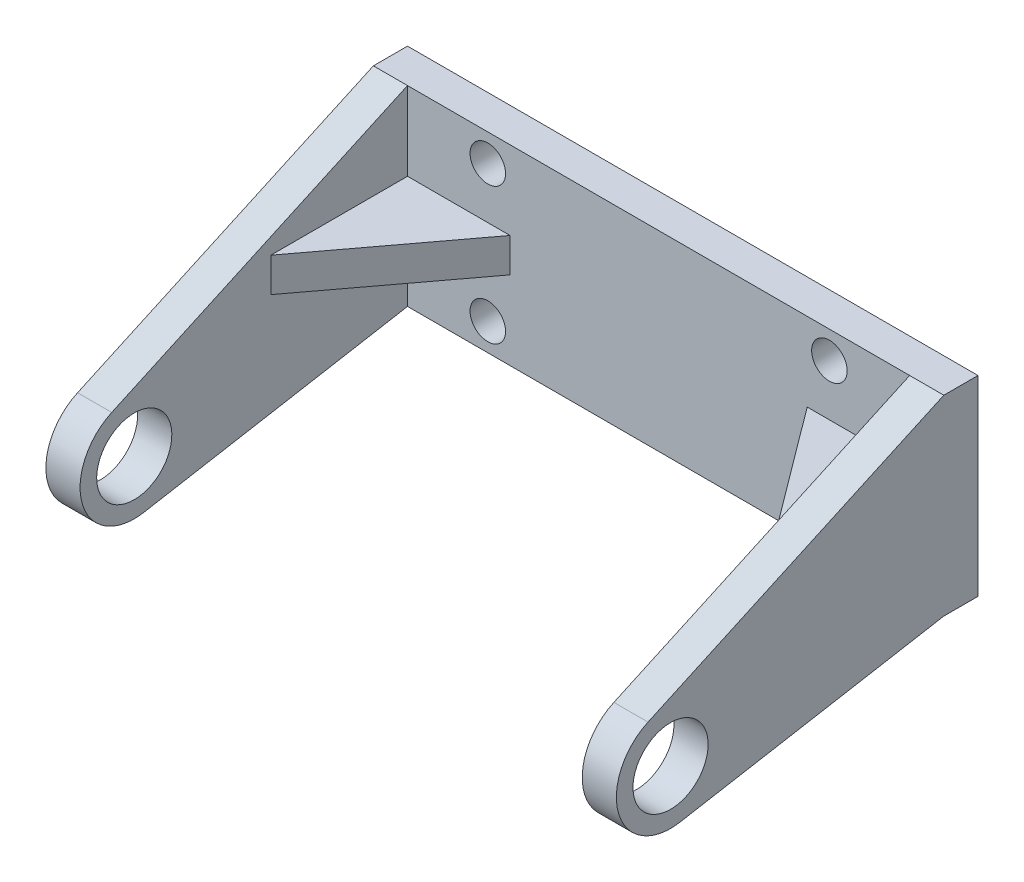
from build123d import *

# Parameters (mm, degrees)
SKETCH_1_W          = 83.5
SKETCH_1_H          = 28
EXTRUDE_1_DEPTH     = 5
SKETCH_2_R          = 5.5
EXTRUDE_2_DEPTH     = 5
EXTRUDE_START       = -5
SKETCH_3_R          = 5.5
EXTRUDE_3_DEPTH     = 5
SKETCH_4_R          = 2.6
CUT_EXTRUDE_2_DEPTH = 5
EXTRUDE_4_DEPTH     = 2.5


with BuildPart() as part:
    # 草图1 → 凸台-拉伸1 (new body)
    with BuildSketch(Plane.XY):
        Rectangle(SKETCH_1_W, SKETCH_1_H)
    extrude(amount=EXTRUDE_1_DEPTH)

    # 草图2 → 凸台-拉伸2 (add)
    with BuildSketch(Plane.ZY.offset(41.75)):
        with BuildLine():
            Line((5, 14), (5, -14))
            Line((5, -14), (43.622842344, -20.810249177))
            ThreePointArc((43.622842344, -20.810249177), (52.5727616, -15.355809237), (48.296475179, -5.786831015))
            Line((48.296475179, -5.786831015), (5, 14))
        make_face()
        with Locations(Location((45, -13, 0), (0, 0, 270))):
            Circle(SKETCH_2_R, mode=Mode.SUBTRACT)
    extrude(amount=-EXTRUDE_2_DEPTH)

    # 草图3 → 凸台-拉伸3 (add)
    with BuildSketch(Plane(origin=(41.75, 0, 0), x_dir=(0, 0, -1), z_dir=(1, 0, 0)).offset(EXTRUDE_START)):
        with BuildLine():
            Line((-5, 14), (-48.296475179, -5.786831015))
            ThreePointArc((-48.296475179, -5.786831015), (-52.5727616, -15.355809237), (-43.622842344, -20.810249177))
            Line((-43.622842344, -20.810249177), (-5, -14))
            Line((-5, -14), (-5, 14))
        make_face()
        with Locations(Location((-45, -13, 0), (0, 0, 270))):
            Circle(SKETCH_3_R, mode=Mode.SUBTRACT)
    extrude(amount=EXTRUDE_3_DEPTH)

    # 草图4 → 切除-拉伸2 (cut)
    with BuildSketch(Plane.XY.offset(5)):
        with Locations((-25, 10)):
            Circle(SKETCH_4_R)
        with Locations((25, 10)):
            Circle(SKETCH_4_R)
        with Locations((25, -10)):
            Circle(SKETCH_4_R)
        with Locations((-25, -10)):
            Circle(SKETCH_4_R)
    extrude(amount=-CUT_EXTRUDE_2_DEPTH, mode=Mode.SUBTRACT)

    # 草图5 → 凸台-拉伸4 (add, symmetric)
    with BuildSketch(Plane(origin=(0, 0, 0), x_dir=(1, 0, 0), z_dir=(0, 1, 0))):
        Polygon((-36.75, -5), (-21.75, -5), (-36.75, -25), align=None)
        Polygon((36.75, -5), (36.75, -25.085459481), (21.75, -5), align=None)
    extrude(amount=EXTRUDE_4_DEPTH, both=True)


solid = part.part
